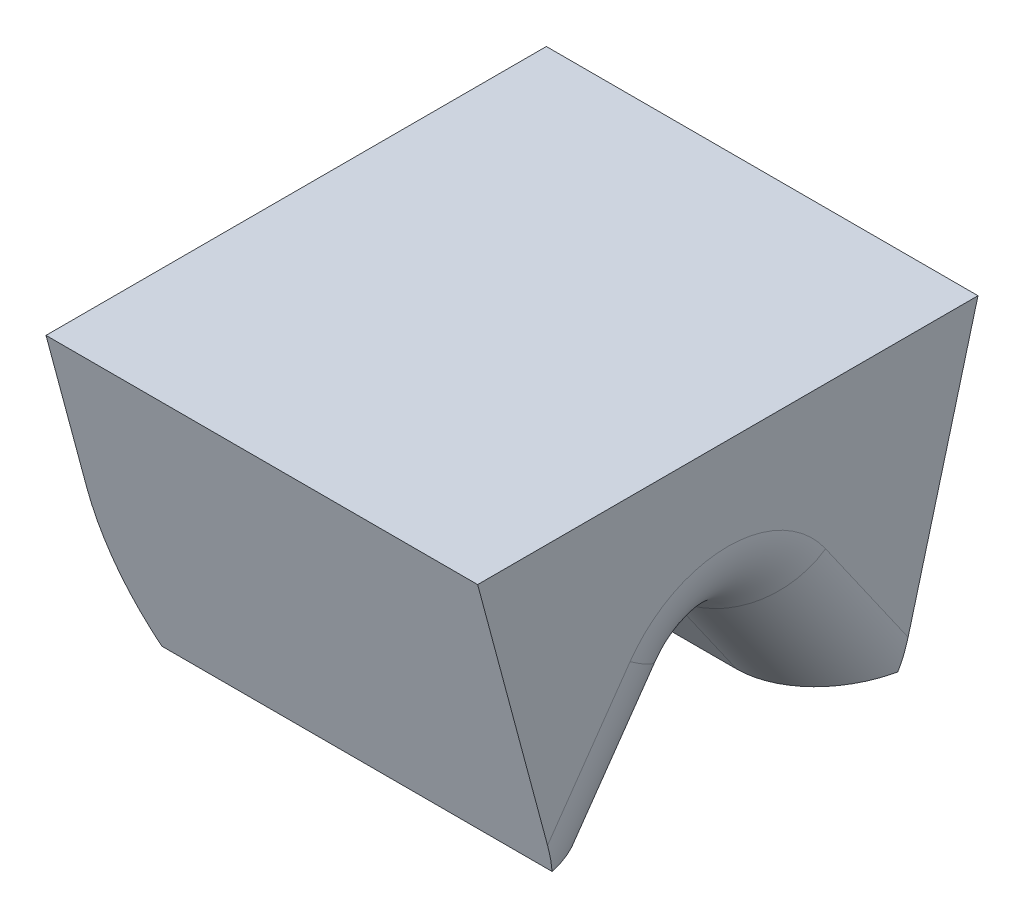
from build123d import *

# Parameters (mm, degrees)
SKETCH_TL_CUTTING_R    = 1.99771
TL_CUTTING_DEPTH       = 29.999999944
SKETCH_TDF_CUTTING_W   = 4.01541996
SKETCH_TDF_CUTTING_H   = 4.01541996
TDF_CUTTING_DEPTH      = 31.132734478
VW_VR_GRINDING_DEPTH   = 2.00770998
VW_VR_GRINDING_2_DEPTH = 2.00770998
ISA_GRINDING_DEPTH     = 2.00770998
SKETCH_PRE_FRX_BRX_W   = 0.93996002
SKETCH_PRE_FRX_BRX_H   = 1.6256
SKETCH_PRE_FRX_BRX_W_2 = 1.81577996
PRE_FRX_BRX_DEPTH      = 2.00770998
FA_BA_GRINDING_DEPTH   = 2.00770998
BR_EDM_R               = 0.24892
FR_EDM_R               = 0.50038


with BuildPart() as part:
    # sketch_TL_cutting → TL_cutting (new body)
    with BuildSketch(Plane(origin=(0, 0, 0), x_dir=(1, 0, 0), z_dir=(0, 1, 0))):
        with Locations(Location((0, 0, 0), (0, 0, 270))):
            Circle(SKETCH_TL_CUTTING_R)
    extrude(amount=TL_CUTTING_DEPTH)

    # sketch_TDF_cutting → TDF_cutting (cut, through all)
    with BuildSketch(Plane(origin=(0, 0, 0), x_dir=(1, 0, 0), z_dir=(0, 1, 0))):
        with Locations((-3.60917998, 0)):
            Rectangle(SKETCH_TDF_CUTTING_W, SKETCH_TDF_CUTTING_H)
    extrude(amount=TDF_CUTTING_DEPTH, mode=Mode.SUBTRACT)


with BuildPart() as body_2:
    # sketch_VW_VR_grinding → VW_VR_grinding (new, symmetric)
    with BuildSketch(Plane(origin=(0, 0, 0), x_dir=(0, 0, -1), z_dir=(1, 0, 0))):
        with BuildLine():
            Line((-1.59004, -0.00999998), (-1.59004, 9.985377879))
            ThreePointArc((-1.59004, 9.985377879), (-1.591006547, 10.007515438), (-1.593898831, 10.029484517))
            Line((-1.593898831, 10.029484517), (-2.01770996, 12.433036869))
            Line((-2.01770996, 12.433036869), (-2.00770998, -0.00999998))
            Line((-2.00770998, -0.00999998), (-1.59004, -0.00999998))
        make_face()
    extrude(amount=VW_VR_GRINDING_DEPTH, both=True)


with BuildPart() as body_3:
    # sketch_VW_VR_grinding → VW_VR_grinding 2 (new, symmetric)
    with BuildSketch(Plane(origin=(0, 0, 0), x_dir=(0, 0, -1), z_dir=(1, 0, 0))):
        with BuildLine():
            Line((1.59004, -0.00999998), (1.59004, 9.985377879))
            ThreePointArc((1.59004, 9.985377879), (1.591006547, 10.007515438), (1.593898831, 10.029484517))
            Line((1.593898831, 10.029484517), (2.01770996, 12.433036869))
            Line((2.01770996, 12.433036869), (2.00770998, -0.00999998))
            Line((2.00770998, -0.00999998), (1.59004, -0.00999998))
        make_face()
    extrude(amount=VW_VR_GRINDING_2_DEPTH, both=True)


    add(body_2.part)  # ISA_grinding merges body 2
    # sketch_ISA_grinding → ISA_grinding (add, symmetric)
    with BuildSketch(Plane(origin=(0, 0, 0), x_dir=(0, 0, -1), z_dir=(1, 0, 0))):
        Polygon((-0.50038, 0), (0.50038, 0), (2.00770998, 5.625432069), (2.00770998, -0.02999994), (-2.00770998, -0.02999994), (-2.00770998, 5.625432069), align=None)
    extrude(amount=ISA_GRINDING_DEPTH, both=True)

    # sketch_pre_FRX_BRX → pre_FRX_BRX (add, symmetric)
    with BuildSketch(Plane.XY):
        with Locations((1.52772999, 0.80280002)):
            Rectangle(SKETCH_PRE_FRX_BRX_W, SKETCH_PRE_FRX_BRX_H)
        with Locations((-1.10981998, 0.80280002)):
            Rectangle(SKETCH_PRE_FRX_BRX_W_2, SKETCH_PRE_FRX_BRX_H)
    extrude(amount=PRE_FRX_BRX_DEPTH, both=True)

    # sketch_FA_BA_grinding → FA_BA_grinding (add, symmetric)
    with BuildSketch(Plane.XY):
        Polygon((1.04775, -0.00999998), (1.04775, 1.6256), (2.12471, 9.288568576), (2.12471, -0.00999998), align=None)
        Polygon((-0.20193, -0.00999998), (-0.20193, 1.6256), (-1.72847, 12.487496496), (-1.72847, -0.00999998), align=None)
    extrude(amount=FA_BA_GRINDING_DEPTH, both=True)


with BuildPart() as part_1:
    add(part.part)

    # B1_fix: cut body 3
    add(body_3.part, mode=Mode.SUBTRACT)

    # V-Groove_EDM: sweep along a path in sketch_contour_V-Groove
    with BuildLine(Plane.XY) as v_groove_edm_path:
        Line((-1.60147, 0.32004), (1.99771, 0.32004))
    # sketch_section_V-Groove → V-Groove_EDM (sweep, cut)
    with BuildSketch(Plane(origin=(-1.60147, 0, -1.2954), x_dir=(0, 0, -1), z_dir=(1, 0, 0))):
        with BuildLine():
            Line((-1.216335445, 0.278881598), (-1.014058386, -0.00999998))
            Line((-1.014058386, -0.00999998), (-1.576741614, -0.00999998))
            Line((-1.576741614, -0.00999998), (-1.374464555, 0.278881598))
            ThreePointArc((-1.374464555, 0.278881598), (-1.2954, 0.32004), (-1.216335445, 0.278881598))
        make_face()
    sweep(path=v_groove_edm_path.line, mode=Mode.SUBTRACT)

    # BR_EDM
    br_edm_edges = [part_1.edges().sort_by_distance(p)[0] for p in [
        (1.04775, 0.139440799, -0.176702054),
        (1.04775, 0.32004, 0),
        (1.04775, 0.139440799, 0.176702054),
    ]]
    fillet(br_edm_edges, radius=BR_EDM_R)

    # FR_EDM
    fr_edm_edges = [part_1.edges().sort_by_distance(p)[0] for p in [
        (-0.20193, 0.32004, 0),
        (-0.20193, 0.139440799, -0.176702054),
        (-0.20193, 0.139440799, 0.176702054),
    ]]
    fillet(fr_edm_edges, radius=FR_EDM_R)

    # SurfaceCut1
    split(bisect_by=Plane(origin=(0, 0.835526316, 0), x_dir=(1, 0, 0), z_dir=(0, 1, 0)), keep=Keep.BOTTOM)


solid = part_1.part
